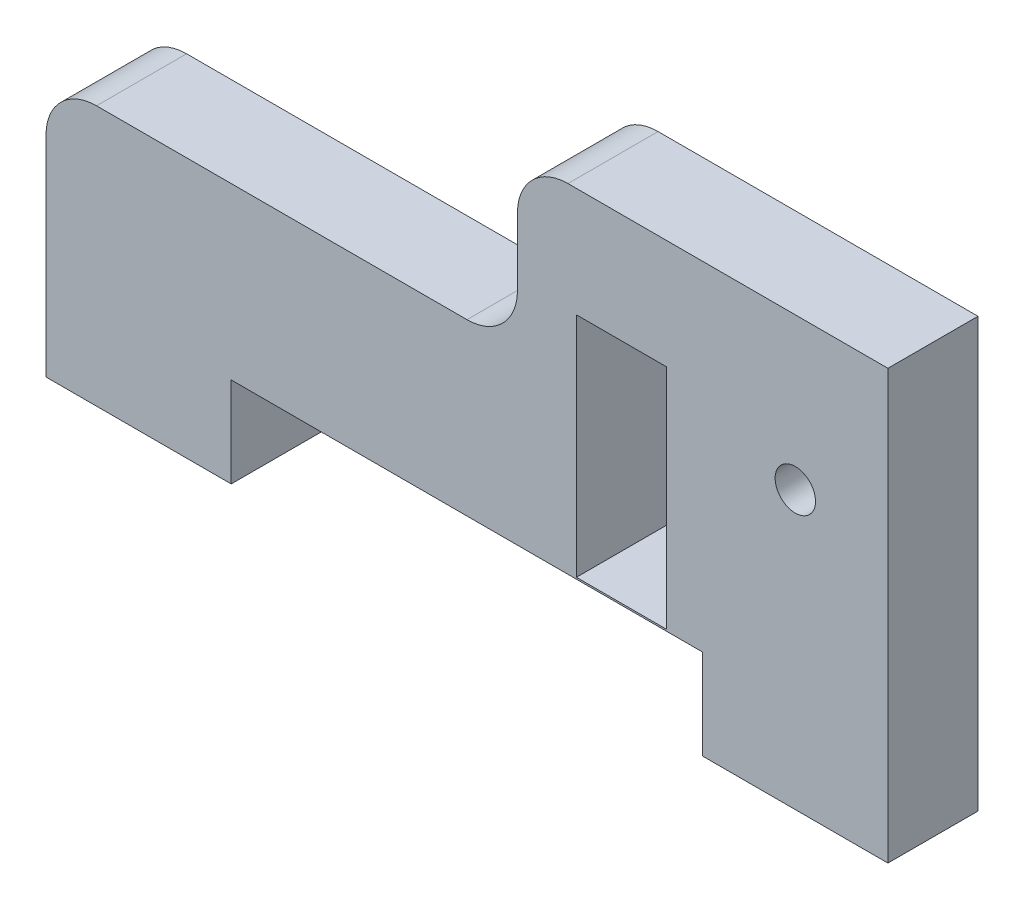
from build123d import *

# Parameters (mm, degrees)
MODEL_R             = 1.2
MODEL_W             = 5.350001156
MODEL_H             = 13.50000035
BOSS_EXTRUDE1_DEPTH = 5.35


with BuildPart() as part:
    # Model → Boss-Extrude1 (new body)
    with BuildSketch(Plane.XY):
        with BuildLine():
            Line((3.000000026, 15.449999832), (25.000000373, 15.449999832))
            ThreePointArc((25.000000373, 15.449999832), (27.121321034, 16.328679314), (28.000000864, 18.449999832))
            Line((28.000000864, 18.449999832), (28.000000864, 22.45000054))
            ThreePointArc((28.000000864, 22.45000054), (28.878680036, 24.571320398), (30.999999493, 25.450000539))
            Line((30.999999493, 25.450000539), (50.000000745, 25.450000539))
            Line((50.000000745, 25.450000539), (50.000000745, 0))
            Line((50.000000745, 0), (39.000000805, 0))
            Line((39.000000805, 0), (39.000000805, 5.350000225))
            Line((39.000000805, 5.350000225), (10.99999994, 5.350000225))
            Line((10.99999994, 5.350000225), (10.99999994, 0))
            Line((10.99999994, 0), (0, 0))
            Line((0, 0), (0, 12.449999832))
            ThreePointArc((0, 12.449999832), (0.878679666, 14.571320184), (3.000000026, 15.449999832))
        make_face()
        with Locations((44.5, 16.45)):
            Circle(MODEL_R, mode=Mode.SUBTRACT)
        with Locations((34.175001085, 12.20000023)):
            Rectangle(MODEL_W, MODEL_H, mode=Mode.SUBTRACT)
    extrude(amount=BOSS_EXTRUDE1_DEPTH)


solid = part.part
